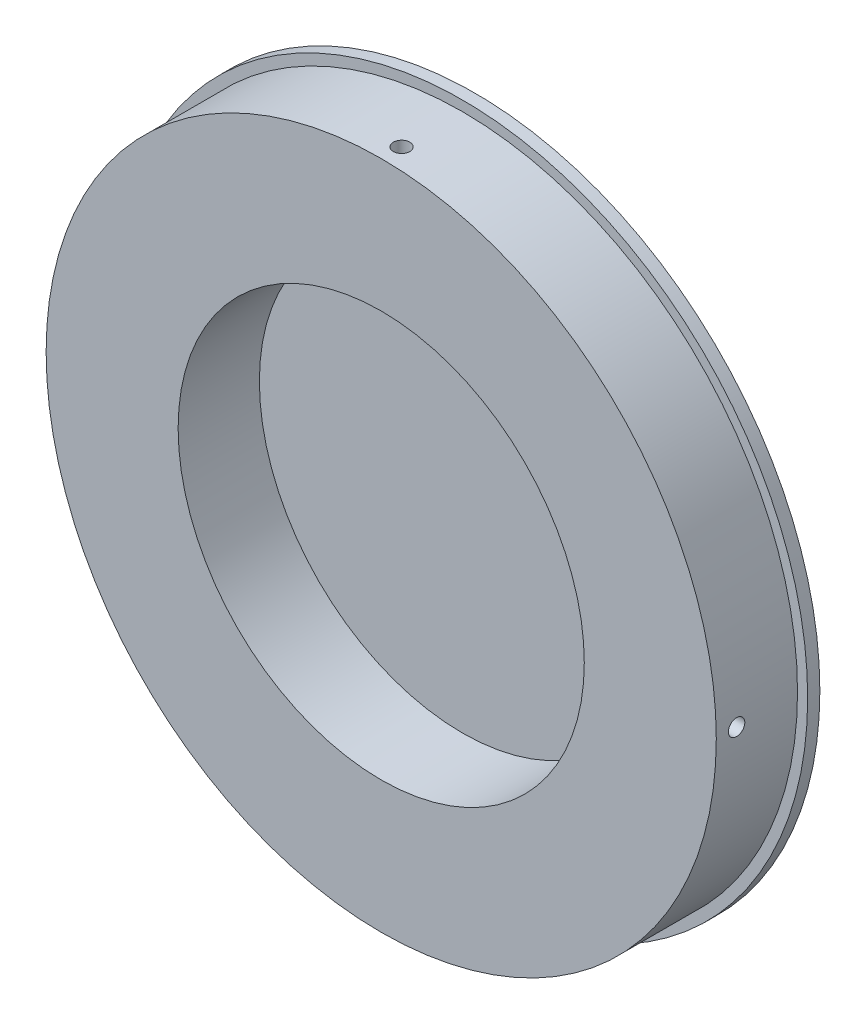
from build123d import *

# Parameters (mm, degrees)
SKETCH1_R           = 85
BOSS_EXTRUDE2_DEPTH = 3
SKETCH2_R           = 82.5
BOSS_EXTRUDE3_DEPTH = 20
SKETCH3_R           = 50
CUT_EXTRUDE1_DEPTH  = 20
SKETCH9_R           = 2.0193
CUT_EXTRUDE5_DEPTH  = 19.05
CUT_EXTRUDE6_START  = 19.05
SKETCH10_R          = 2.0193
CUT_EXTRUDE6_DEPTH  = 19.05
SKETCH11_R          = 2.0193
CUT_EXTRUDE7_DEPTH  = 19.05
CUT_EXTRUDE8_START  = 19.05
SKETCH12_R          = 2.0193
CUT_EXTRUDE8_DEPTH  = 19.05


with BuildPart() as part:
    # Sketch1 → Boss-Extrude2 (new body)
    with BuildSketch(Plane.XY):
        Circle(SKETCH1_R)
    extrude(amount=BOSS_EXTRUDE2_DEPTH)

    # Sketch2 → Boss-Extrude3 (add)
    with BuildSketch(Plane.XY.offset(3)):
        Circle(SKETCH2_R)
    extrude(amount=BOSS_EXTRUDE3_DEPTH)

    # Sketch3 → Cut-Extrude1 (cut)
    with BuildSketch(Plane.XY.offset(23)):
        Circle(SKETCH3_R)
    extrude(amount=-CUT_EXTRUDE1_DEPTH, mode=Mode.SUBTRACT)

    # Sketch9 → Cut-Extrude5 (cut)
    with BuildSketch(Plane(origin=(0, 82.5, 0), x_dir=(-1, 0, 0), z_dir=(0, -1, 0))):
        with Locations((0, -18)):
            Circle(SKETCH9_R)
    extrude(amount=CUT_EXTRUDE5_DEPTH, mode=Mode.SUBTRACT)

    # Sketch10 → Cut-Extrude6 (cut)
    with BuildSketch(Plane(origin=(0, -82.5, 0), x_dir=(1, 0, 0), z_dir=(0, 1, 0)).offset(CUT_EXTRUDE6_START)):
        with Locations(Location((0, -18, 0), (0, 0, 180))):
            Circle(SKETCH10_R)
    extrude(amount=-CUT_EXTRUDE6_DEPTH, mode=Mode.SUBTRACT)

    # Sketch11 → Cut-Extrude7 (cut)
    with BuildSketch(Plane(origin=(82.5, 0, 0), x_dir=(0, 0, -1), z_dir=(1, 0, 0))):
        with Locations((-18, 0)):
            Circle(SKETCH11_R)
    extrude(amount=-CUT_EXTRUDE7_DEPTH, mode=Mode.SUBTRACT)

    # Sketch12 → Cut-Extrude8 (cut)
    with BuildSketch(Plane(origin=(-82.5, 0, 0), x_dir=(0, 0, -1), z_dir=(1, 0, 0)).offset(CUT_EXTRUDE8_START)):
        with Locations((-18, 0)):
            Circle(SKETCH12_R)
    extrude(amount=-CUT_EXTRUDE8_DEPTH, mode=Mode.SUBTRACT)


solid = part.part
